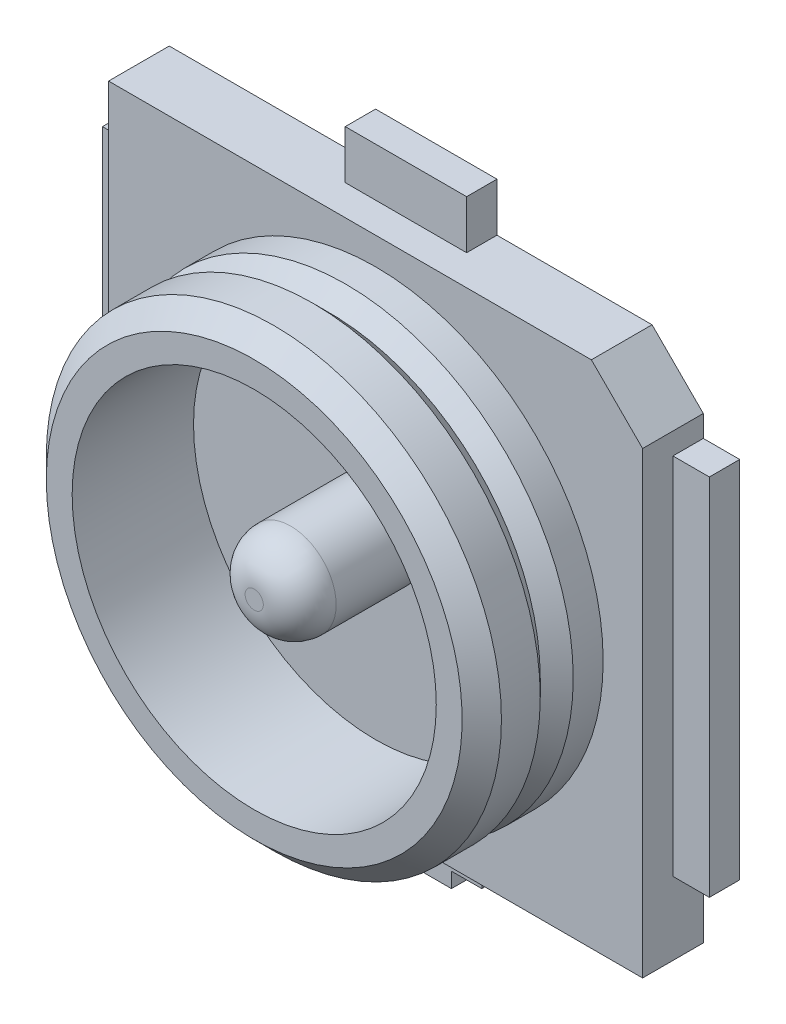
from build123d import *

# Parameters (mm, degrees)
BOSS_EXTRUDE1_DEPTH = 0.2
SKETCH3_R           = 0.15
BOSS_EXTRUDE2_DEPTH = 0.4
FILLET1_R           = 0.12
SKETCH4_W           = 0.4
SKETCH4_H           = 0.16
SKETCH4_W_2         = 0.12
SKETCH4_H_2         = 1.2
BOSS_EXTRUDE3_DEPTH = 0.1


with BuildPart() as part:
    # Sketch1 → Boss-Extrude1 (new body)
    with BuildSketch(Plane.XY):
        Polygon((0.711160981, 0.84), (0.88, 0.671160981), (0.88, -0.84), (-0.88, -0.84), (-0.88, 0.84), align=None)
    extrude(amount=BOSS_EXTRUDE1_DEPTH)

    # Sketch2 → Revolve1 (revolve)
    with BuildSketch(Plane(origin=(0, 0, 0), x_dir=(1, 0, 0), z_dir=(0, 1, 0)), mode=Mode.PRIVATE) as revolve1_sk:
        Polygon((0.75, -0.2), (0.75, -0.298667135), (0.695670226, -0.35299691), (0.75, -0.407326684), (0.75, -0.535218952), (0.685218952, -0.6), (0.6, -0.6), (0.6, -0.2), align=None)
    revolve(revolve1_sk.sketch.rotate(Axis((0, 0, -0.03), (0, 0, 1)), 180), axis=Axis((0, 0, -0.03), (0, 0, 1)))

    # Sketch3 → Boss-Extrude2 (add)
    with BuildSketch(Plane.XY.offset(0.2)):
        with Locations(Location((0, 0, 0), (0, 0, 180))):
            Circle(SKETCH3_R)
    extrude(amount=BOSS_EXTRUDE2_DEPTH)

    # Fillet1
    fillet1_edges = [part.edges().sort_by_distance(p)[0] for p in [
        (0.15, 0, 0.6),
    ]]
    fillet(fillet1_edges, radius=FILLET1_R)

    # Sketch4 → Boss-Extrude3 (add)
    with BuildSketch(Plane.XY):
        with Locations((0, 0.92)):
            Rectangle(SKETCH4_W, SKETCH4_H)
        Polygon((-0.25, -0.84), (0.25, -0.84), (0.25, -0.95), (0.15, -0.95), (0.15, -1), (-0.15, -1), (-0.15, -0.95), (-0.25, -0.95), align=None)
        with Locations((-0.94, 0)):
            Rectangle(SKETCH4_W_2, SKETCH4_H_2)
        with Locations((0.94, 0)):
            Rectangle(SKETCH4_W_2, SKETCH4_H_2)
    extrude(amount=BOSS_EXTRUDE3_DEPTH)


solid = part.part
